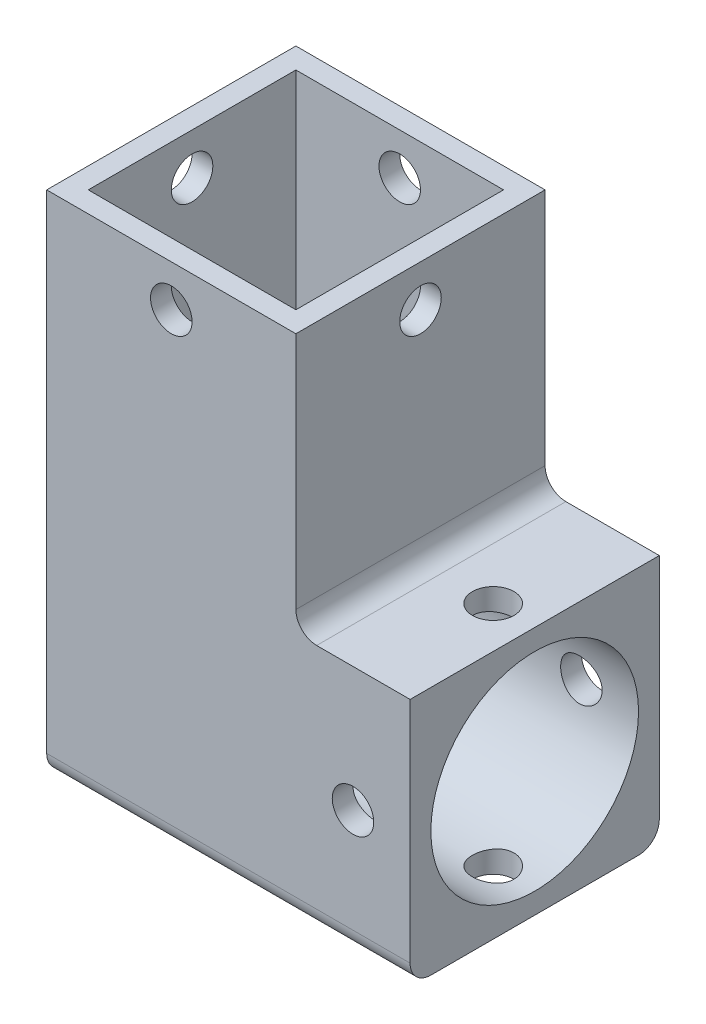
from build123d import *

# Parameters (mm, degrees)
BOSS_EXTRUDE1_DEPTH = 24
SKETCH2_W           = 20
SKETCH2_H           = 20
CUT_EXTRUDE2_DEPTH  = 25
SKETCH3_R           = 10
CUT_EXTRUDE3_DEPTH  = 50.254441424
SKETCH4_R           = 2
CUT_EXTRUDE4_DEPTH  = 25
SKETCH5_R           = 2
CUT_EXTRUDE5_DEPTH  = 25
SKETCH6_R           = 2
CUT_EXTRUDE6_DEPTH  = 25
SKETCH7_R           = 2
CUT_EXTRUDE7_DEPTH  = 25
FILLET1_R           = 2


with BuildPart() as part:
    # Sketch1 → Boss-Extrude1 (new body)
    with BuildSketch(Plane.XY):
        Polygon((-35, 25), (-35, -24), (0, -24), (0, 0), (-11, 0), (-11, 25), align=None)
    extrude(amount=BOSS_EXTRUDE1_DEPTH)

    # Sketch2 → Cut-Extrude2 (cut)
    with BuildSketch(Plane(origin=(0, 25, 0), x_dir=(1, 0, 0), z_dir=(0, 1, 0))):
        with Locations((-23, -12)):
            Rectangle(SKETCH2_W, SKETCH2_H)
    extrude(amount=-CUT_EXTRUDE2_DEPTH, mode=Mode.SUBTRACT)

    # Sketch3 → Cut-Extrude3 (cut, through all)
    with BuildSketch(Plane(origin=(0, 0, 0), x_dir=(0, 0, -1), z_dir=(1, 0, 0))):
        with Locations((-12, -12)):
            Circle(SKETCH3_R)
    extrude(amount=-CUT_EXTRUDE3_DEPTH, mode=Mode.SUBTRACT)

    # Sketch4 → Cut-Extrude4 (cut)
    with BuildSketch(Plane(origin=(-11, 0, 0), x_dir=(0, 0, -1), z_dir=(1, 0, 0))):
        with Locations((-12, 21)):
            Circle(SKETCH4_R)
    extrude(amount=-CUT_EXTRUDE4_DEPTH, mode=Mode.SUBTRACT)

    # Sketch5 → Cut-Extrude5 (cut)
    with BuildSketch(Plane(origin=(0, 0, 0), x_dir=(-1, 0, 0), z_dir=(0, 0, -1))):
        with Locations((23, 21)):
            Circle(SKETCH5_R)
    extrude(amount=-CUT_EXTRUDE5_DEPTH, mode=Mode.SUBTRACT)

    # Sketch6 → Cut-Extrude6 (cut)
    with BuildSketch(Plane(origin=(0, 0, 0), x_dir=(1, 0, 0), z_dir=(0, 1, 0))):
        with Locations(Location((-4, -12, 0), (0, 0, 180))):
            Circle(SKETCH6_R)
    extrude(amount=-CUT_EXTRUDE6_DEPTH, mode=Mode.SUBTRACT)

    # Sketch7 → Cut-Extrude7 (cut)
    with BuildSketch(Plane(origin=(0, 0, 0), x_dir=(-1, 0, 0), z_dir=(0, 0, -1))):
        with Locations((5.5, -12)):
            Circle(SKETCH7_R)
    extrude(amount=-CUT_EXTRUDE7_DEPTH, mode=Mode.SUBTRACT)

    # Fillet1
    fillet1_edges = [part.edges().sort_by_distance(p)[0] for p in [
        (-11, 0, 12),
        (-17.5, -24, 24),
        (-17.5, -24, 0),
    ]]
    fillet(fillet1_edges, radius=FILLET1_R)


solid = part.part
